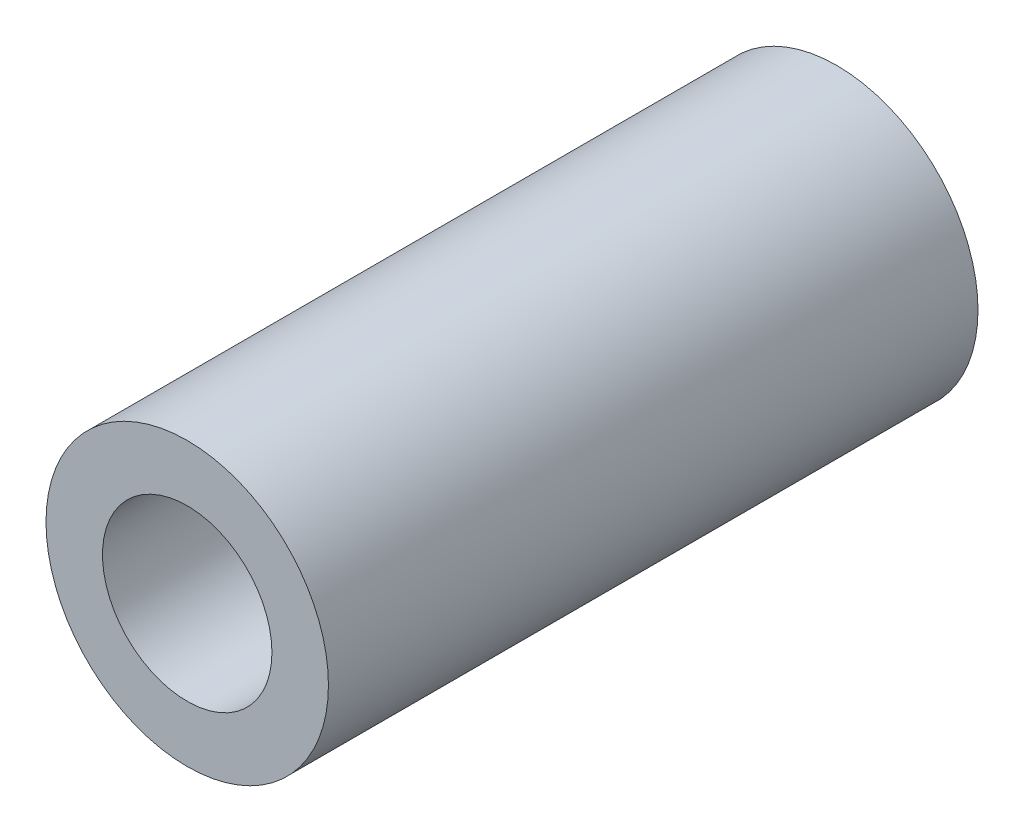
from build123d import *

# Parameters (mm, degrees)
SKETCH_1_R      = 5
SKETCH_1_R_2    = 3
EXTRUDE_1_DEPTH = 23


with BuildPart() as part:
    # 草图1 → 凸台-拉伸1 (new body)
    with BuildSketch(Plane.XY):
        Circle(SKETCH_1_R)
        Circle(SKETCH_1_R_2, mode=Mode.SUBTRACT)
    extrude(amount=EXTRUDE_1_DEPTH)


solid = part.part
